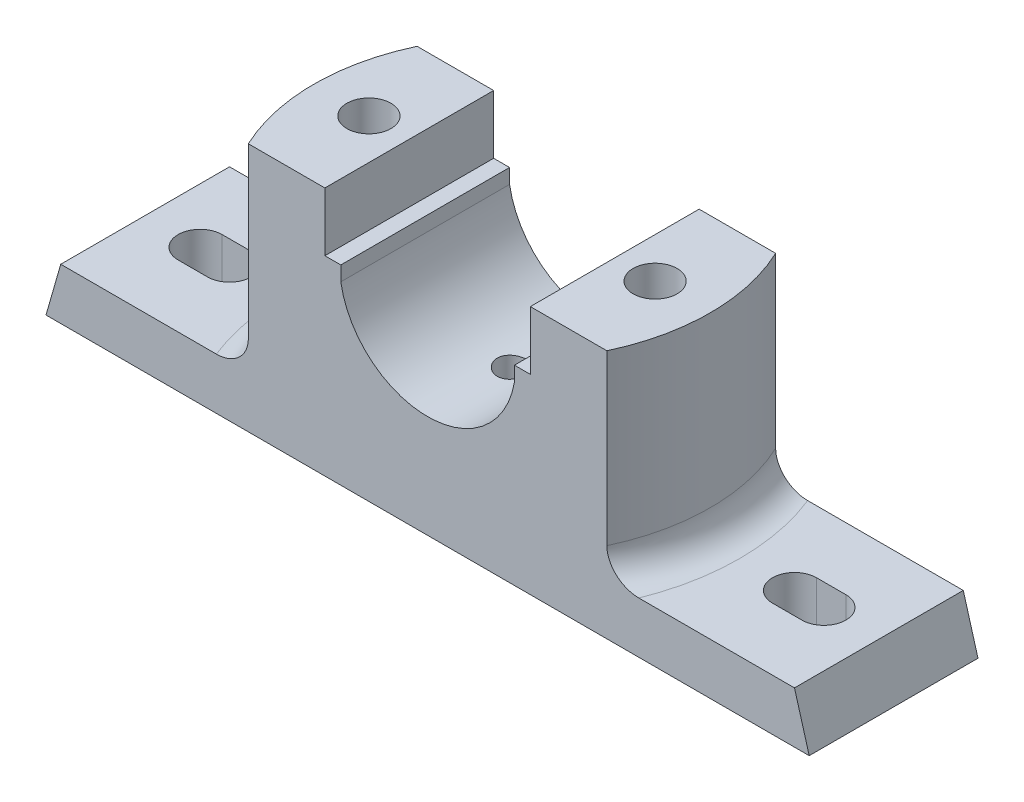
from build123d import *

# Parameters (mm, degrees)
BOSS_EXTRUDE1_DEPTH = 23
BOSS_EXTRUDE2_START = -14
BOSS_EXTRUDE2_DEPTH = 68
CUT_EXTRUDE1_DEPTH  = 34
SKETCH4_R           = 6
CUT_EXTRUDE2_DEPTH  = 127.368508735
SKETCH5_W           = 28
SKETCH5_H           = 28
CUT_EXTRUDE3_DEPTH  = 10
CUT_EXTRUDE4_DEPTH  = 16
CUT_EXTRUDE5_DEPTH  = 120.419428905
FILLET1_R           = 8


with BuildPart() as part:
    # Sketch1 → Boss-Extrude1 (new, symmetric)
    with BuildSketch(Plane.XY):
        Polygon((104, 0), (-104, 0), (-99.985564599, 14), (99.985564599, 14), align=None)
    extrude(amount=BOSS_EXTRUDE1_DEPTH, both=True)

    # Sketch2 → Boss-Extrude2 (add)
    with BuildSketch(Plane(origin=(0, 14, 0), x_dir=(1, 0, 0), z_dir=(0, 1, 0)).offset(BOSS_EXTRUDE2_START)):
        with BuildLine():
            Line((48.856934001, 23), (-48.856934001, 23))
            ThreePointArc((-48.856934001, 23), (-54, 0), (-48.856934001, -23))
            Line((-48.856934001, -23), (48.856934001, -23))
            ThreePointArc((48.856934001, -23), (54, 0), (48.856934001, 23))
        make_face()
    extrude(amount=BOSS_EXTRUDE2_DEPTH)

    # Sketch3 → Cut-Extrude1 (cut, symmetric)
    with BuildSketch(Plane.XY):
        with BuildLine():
            Line((-28, 68), (-28, 52))
            Line((-28, 52), (-23.661097096, 52))
            Line((-23.661097096, 52), (-23.661097096, 48))
            ThreePointArc((-23.661097096, 48), (0, 28.019015328), (23.661097096, 48))
            Line((23.661097096, 48), (23.661097096, 52))
            Line((23.661097096, 52), (28, 52))
            Line((28, 52), (28, 68))
            Line((28, 68), (-28, 68))
        make_face()
    extrude(amount=CUT_EXTRUDE1_DEPTH, both=True, mode=Mode.SUBTRACT)

    # Sketch4 → Cut-Extrude2 (cut, through all)
    with BuildSketch(Plane(origin=(0, 68, 0), x_dir=(1, 0, 0), z_dir=(0, 1, 0))):
        with Locations(Location((-39, 0, 0), (0, 0, 270))):
            Circle(SKETCH4_R)
        with Locations(Location((39, 0, 0), (0, 0, 90))):
            Circle(SKETCH4_R)
    extrude(amount=-CUT_EXTRUDE2_DEPTH, mode=Mode.SUBTRACT)

    # Sketch5 → Cut-Extrude3 (cut)
    with BuildSketch(Plane.XZ):
        with Locations((-39, 0)):
            Rectangle(SKETCH5_W, SKETCH5_H)
        with Locations((39, 0)):
            Rectangle(SKETCH5_W, SKETCH5_H)
    extrude(amount=-CUT_EXTRUDE3_DEPTH, mode=Mode.SUBTRACT)

    # Sketch6 → Cut-Extrude4 (cut, symmetric)
    with BuildSketch(Plane.XY):
        Polygon((-97.5, 0), (-96.926509228, 2), (96.926509228, 2), (97.5, 0), align=None)
    extrude(amount=CUT_EXTRUDE4_DEPTH, both=True, mode=Mode.SUBTRACT)

    # Sketch7 → Cut-Extrude5 (cut, through all)
    with BuildSketch(Plane(origin=(0, 14, 0), x_dir=(1, 0, 0), z_dir=(0, 1, 0))):
        with BuildLine():
            Line((-85, 6), (-77, 6))
            ThreePointArc((-77, 6), (-71, 0), (-77, -6))
            Line((-77, -6), (-85, -6))
            ThreePointArc((-85, -6), (-91, 0), (-85, 6))
        make_face()
        with BuildLine():
            Line((85, 6), (77, 6))
            ThreePointArc((77, 6), (71, 0), (77, -6))
            Line((77, -6), (85, -6))
            ThreePointArc((85, -6), (91, 0), (85, 6))
        make_face()
    extrude(amount=-CUT_EXTRUDE5_DEPTH, mode=Mode.SUBTRACT)

    # Sketch8 → Cut-Revolve1 (revolve, cut)
    with BuildSketch(Plane.XY, mode=Mode.PRIVATE) as cut_revolve1_sk:
        Polygon((4, 22.422457805), (0, 20.019015328), (0, 28.019015328), (0, 30.422457805), (4, 30.422457805), align=None)
    revolve(cut_revolve1_sk.sketch.rotate(Axis((0, 28.019015328, 0), (0, -1, 0)), 180), axis=Axis((0, 28.019015328, 0), (0, -1, 0)), mode=Mode.SUBTRACT)

    # Fillet1
    fillet1_edges = [part.edges().sort_by_distance(p)[0] for p in [
        (54, 14, 0),
        (-54, 14, 0),
    ]]
    fillet(fillet1_edges, radius=FILLET1_R)


solid = part.part
